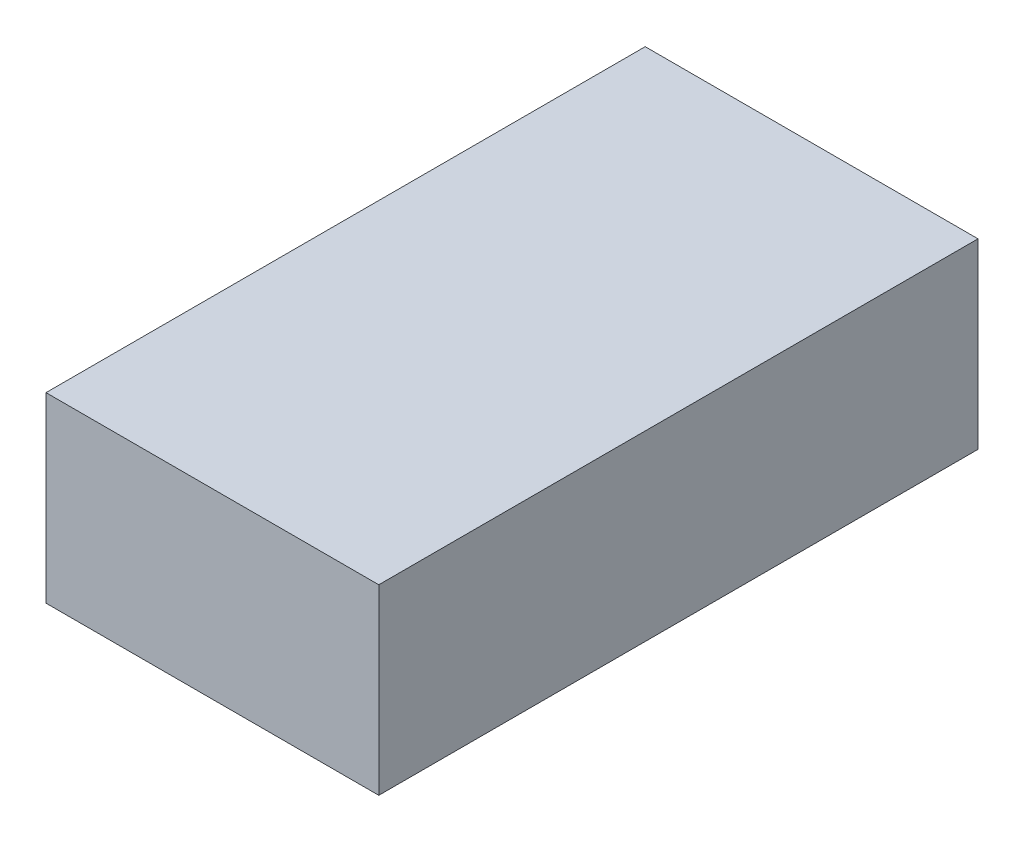
from build123d import *

# Parameters (mm, degrees)
CURVESKETCH_W   = 31.719
CURVESKETCH_H   = 17.381
CURVEBOSS_DEPTH = 28.5565


with BuildPart() as part:
    # CurveSketch → CurveBoss (new, symmetric)
    with BuildSketch(Plane.XY):
        with Locations((-4.193, 6.827)):
            Rectangle(CURVESKETCH_W, CURVESKETCH_H)
    extrude(amount=CURVEBOSS_DEPTH, both=True)


solid = part.part
